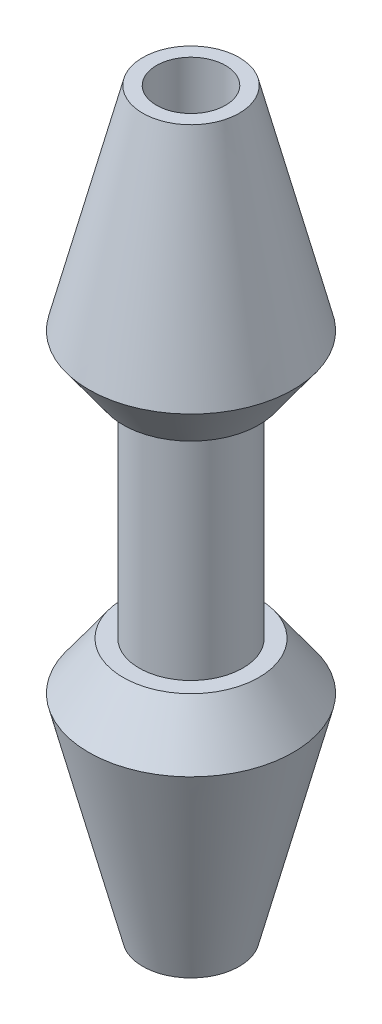
from build123d import *

# Parameters (mm, degrees)
CHAMFER1_SIZE       = 4.28
CHAMFER1_SIZE2      = 4.038825392
SKETCH8_R           = 4.5
BOSS_EXTRUDE2_DEPTH = 9.5
SKETCH9_R           = 3
CUT_EXTRUDE2_DEPTH  = 66.414452097


with BuildPart() as part:
    # Sketch7 → Revolve1 (revolve)
    with BuildSketch(Plane(origin=(0, 0, 0), x_dir=(0, 0, -1), z_dir=(1, 0, 0))):
        Polygon((0, 0), (0, 22.597995894), (4.193169033, 22.597995894), (9.941146123, 0), align=None)
    revolve(axis=Axis((0, 0, 0), (0, 1, 0)))

    # Chamfer1
    chamfer1_edges = [part.edges().sort_by_distance(p)[0] for p in [
        (0, 0, 9.941146123),
    ]]
    chamfer1_side = [part.faces().sort_by_distance(p)[0] for p in [
        (0, 11.298997947, 7.067157578),
    ]]
    chamfer(chamfer1_edges, length=CHAMFER1_SIZE, length2=CHAMFER1_SIZE2, reference=chamfer1_side[0])

    # Sketch8 → Boss-Extrude2 (add)
    with BuildSketch(Plane.XZ):
        Circle(SKETCH8_R)
    extrude(amount=BOSS_EXTRUDE2_DEPTH)

    # Mirror3: part across plane


with BuildPart() as part_1:
    add(part.part)
    add(part.part.mirror(Plane(origin=(0, -9.5, 0), x_dir=(0, 0, 1), z_dir=(0, -1, 0))))

    # Sketch9 → Cut-Extrude2 (cut, through all)
    with BuildSketch(Plane(origin=(0, 22.597995894, 0), x_dir=(1, 0, 0), z_dir=(0, 1, 0))):
        Circle(SKETCH9_R)
    extrude(amount=-CUT_EXTRUDE2_DEPTH, mode=Mode.SUBTRACT)


solid = part_1.part
